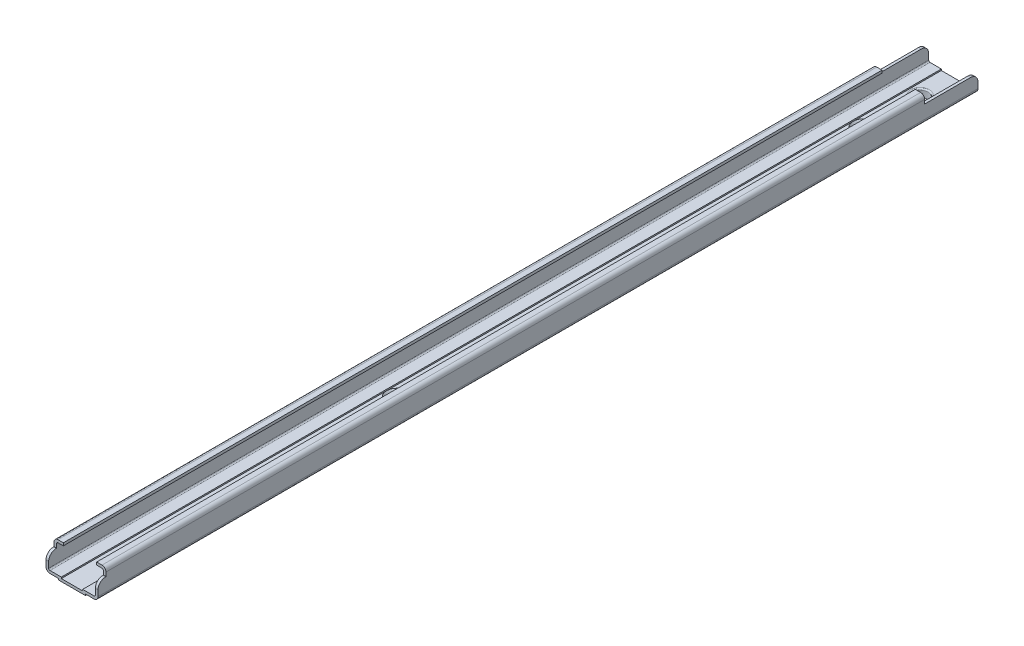
from build123d import *

# Parameters (mm, degrees)
BASE_EXTRU_MINCE_DEPTH            = 330
CONG_1_R                          = 1.5
CONG_2_R                          = 0.5
ENL_V_MAT_EXTRU_1_DEPTH           = 331.295417013
ENL_V_MAT_EXTRU_1_DEPTH_BACK      = 331.295417013
ESQUISSE3_R                       = 3
ENL_V_MAT_EXTRU_4_DEPTH           = 3
BOSS_EXTRU_1_START                = 2
ESQUISSE4_R                       = 3.5
ESQUISSE4_R_2                     = 3
BOSS_EXTRU_1_DEPTH                = 2
CONG_3_R                          = 0.5
ESQUISSE5_R                       = 4.25
BOSS_EXTRU_2_DEPTH                = 1.5
BOSS_EXTRU_2_DRAFT                = -45
BOSS_EXTRU_2_PROFILE_2_DEPTH      = 1.5
BOSS_EXTRU_2_PROFILE_2_DRAFT      = -45
ESQUISSE6_R                       = 4
ENL_V_MAT_EXTRU_6_DEPTH           = 2
ENL_V_MAT_EXTRU_6_DRAFT           = -45
ENL_V_MAT_EXTRU_6_PROFILE_2_DEPTH = 2
ENL_V_MAT_EXTRU_6_PROFILE_2_DRAFT = -45


with BuildPart() as part:
    # Esquisse1 → Base-Extru.-Mince (new body)
    with BuildSketch(Plane.XY):
        Polygon((-6.25, 10), (-9.75, 10), (-9.75, 0.5), (-5, 0.5), (-5, 0), (5, 0), (5, 0.5), (9.75, 0.5), (9.75, 10), (6.25, 10), (6.25, 9), (8.75, 9), (8.75, 1.5), (4, 1.5), (4, 1), (-4, 1), (-4, 1.5), (-8.75, 1.5), (-8.75, 9), (-6.25, 9), align=None)
    extrude(amount=BASE_EXTRU_MINCE_DEPTH)

    # Congé1
    cong_1_edges = [part.edges().sort_by_distance(p)[0] for p in [
        (-9.75, 10, 165),
        (-9.75, 0.5, 165),
        (9.75, 0.5, 165),
        (9.75, 10, 165),
    ]]
    fillet(cong_1_edges, radius=CONG_1_R)

    # Congé2
    cong_2_edges = [part.edges().sort_by_distance(p)[0] for p in [
        (-8.75, 9, 165),
        (-8.75, 1.5, 165),
        (8.75, 1.5, 165),
        (8.75, 9, 165),
    ]]
    fillet(cong_2_edges, radius=CONG_2_R)

    # Esquisse2 → Enlèv. mat.-Extru.1 (cut, two sides: drawn at the far end of the back side and taken through both)
    with BuildSketch(Plane(origin=(0, 0, 0), x_dir=(0, 0, -1), z_dir=(1, 0, 0)).offset(-ENL_V_MAT_EXTRU_1_DEPTH_BACK)):
        with BuildLine():
            Line((-330, 0), (-330, 4.2))
            ThreePointArc((-330, 4.2), (-329.179898987, 6.179898987), (-327.2, 7))
            Line((-327.2, 7), (-327, 7))
            Line((-327, 7), (-327, 10))
            Line((-327, 10), (-332.428830769, 10))
            Line((-332.428830769, 10), (-332.428830769, 0))
            Line((-332.428830769, 0), (-330, 0))
        make_face()
        with BuildLine():
            Line((0.919813001, 11.16366228), (-20, 11.16366228))
            Line((-20, 11.16366228), (-20, 7))
            Line((-20, 7), (-2.8, 7))
            ThreePointArc((-2.8, 7), (-0.820101013, 6.179898987), (0, 4.2))
            Line((0, 4.2), (0, 0))
            Line((0, 0), (0.919813001, 0))
            Line((0.919813001, 0), (0.919813001, 11.16366228))
        make_face()
    extrude(amount=ENL_V_MAT_EXTRU_1_DEPTH + ENL_V_MAT_EXTRU_1_DEPTH_BACK, mode=Mode.SUBTRACT)

    # Esquisse3 → Enlèv. mat.-Extru.4 (cut)
    with BuildSketch(Plane(origin=(0, 0, 0), x_dir=(1, 0, 0), z_dir=(0, 1, 0))):
        with Locations(Location((0, -12, 0), (0, 0, 90))):
            Circle(ESQUISSE3_R)
    extrude(amount=ENL_V_MAT_EXTRU_4_DEPTH, mode=Mode.SUBTRACT)

    # Esquisse4 → Boss.-Extru.1 (add)
    with BuildSketch(Plane.XZ.offset(BOSS_EXTRU_1_START)):
        with Locations(Location((0, 12, 0), (0, 0, 90))):
            Circle(ESQUISSE4_R)
        with Locations(Location((0, 12, 0), (0, 0, 270))):
            Circle(ESQUISSE4_R_2, mode=Mode.SUBTRACT)
    extrude(amount=-BOSS_EXTRU_1_DEPTH)

    # Congé3
    cong_3_edges = [part.edges().sort_by_distance(p)[0] for p in [
        (0, 1, 15),
    ]]
    fillet(cong_3_edges, radius=CONG_3_R)


with BuildPart() as boss_extru_2_tool:
    # Esquisse5 → Boss.-Extru.2 (with draft: the straight prism first)
    with BuildSketch(Plane(origin=(0, 1, 0), x_dir=(-1, 0, 0), z_dir=(0, 1, 0))):
        with Locations((0, 208)):
            Circle(ESQUISSE5_R)
    extrude(amount=-BOSS_EXTRU_2_DEPTH)
    # Boss.-Extru.2: the draft: its side faces are tilted about the plane it starts from
    boss_extru_2_sides = [boss_extru_2_tool.faces().sort_by_distance(p)[0] for p in [
        (4.25, 0.25, 208),
    ]]
    draft(boss_extru_2_sides, Plane(origin=(0, 1, 0), x_dir=(-1, 0, 0), z_dir=(0, 1, 0)), BOSS_EXTRU_2_DRAFT)


with BuildPart() as part_1:
    add(part.part)

    # Boss.-Extru.2: add boss_extru_2_tool
    add(boss_extru_2_tool.part)


with BuildPart() as boss_extru_2_profile_2_tool:
    # Esquisse5 → Boss.-Extru.2 profile 2 (with draft: the straight prism first)
    with BuildSketch(Plane(origin=(0, 1, 0), x_dir=(-1, 0, 0), z_dir=(0, 1, 0))):
        with Locations((0, 34)):
            Circle(ESQUISSE5_R)
    extrude(amount=-BOSS_EXTRU_2_PROFILE_2_DEPTH)
    # Boss.-Extru.2 profile 2: the draft: its side faces are tilted about the plane it starts from
    boss_extru_2_profile_2_sides = [boss_extru_2_profile_2_tool.faces().sort_by_distance(p)[0] for p in [
        (4.25, 0.25, 34),
    ]]
    draft(boss_extru_2_profile_2_sides, Plane(origin=(0, 1, 0), x_dir=(-1, 0, 0), z_dir=(0, 1, 0)), BOSS_EXTRU_2_PROFILE_2_DRAFT)


with BuildPart() as part_2:
    add(part_1.part)

    # Boss.-Extru.2 profile 2: add boss_extru_2_profile_2_tool
    add(boss_extru_2_profile_2_tool.part)


with BuildPart() as enl_v_mat_extru_6_tool:
    # Esquisse6 → Enlèv. mat.-Extru.6 (with draft: the straight prism first)
    with BuildSketch(Plane(origin=(0, 1, 0), x_dir=(-1, 0, 0), z_dir=(0, 1, 0))):
        with Locations((0, 33)):
            Circle(ESQUISSE6_R)
    extrude(amount=-ENL_V_MAT_EXTRU_6_DEPTH)
    # Enlèv. mat.-Extru.6: the draft: its side faces are tilted about the plane it starts from
    enl_v_mat_extru_6_sides = [enl_v_mat_extru_6_tool.faces().sort_by_distance(p)[0] for p in [
        (4, 0, 33),
    ]]
    draft(enl_v_mat_extru_6_sides, Plane(origin=(0, 1, 0), x_dir=(-1, 0, 0), z_dir=(0, 1, 0)), ENL_V_MAT_EXTRU_6_DRAFT)


with BuildPart() as part_3:
    add(part_2.part)

    # Enlèv. mat.-Extru.6: cut by enl_v_mat_extru_6_tool
    add(enl_v_mat_extru_6_tool.part, mode=Mode.SUBTRACT)


with BuildPart() as enl_v_mat_extru_6_profile_2_tool:
    # Esquisse6 → Enlèv. mat.-Extru.6 profile 2 (with draft: the straight prism first)
    with BuildSketch(Plane(origin=(0, 1, 0), x_dir=(-1, 0, 0), z_dir=(0, 1, 0))):
        with Locations((0, 208)):
            Circle(ESQUISSE6_R)
    extrude(amount=-ENL_V_MAT_EXTRU_6_PROFILE_2_DEPTH)
    # Enlèv. mat.-Extru.6 profile 2: the draft: its side faces are tilted about the plane it starts from
    enl_v_mat_extru_6_profile_2_sides = [enl_v_mat_extru_6_profile_2_tool.faces().sort_by_distance(p)[0] for p in [
        (4, 0, 208),
    ]]
    draft(enl_v_mat_extru_6_profile_2_sides, Plane(origin=(0, 1, 0), x_dir=(-1, 0, 0), z_dir=(0, 1, 0)), ENL_V_MAT_EXTRU_6_PROFILE_2_DRAFT)


with BuildPart() as part_4:
    add(part_3.part)

    # Enlèv. mat.-Extru.6 profile 2: cut by enl_v_mat_extru_6_profile_2_tool
    add(enl_v_mat_extru_6_profile_2_tool.part, mode=Mode.SUBTRACT)


solid = part_4.part
